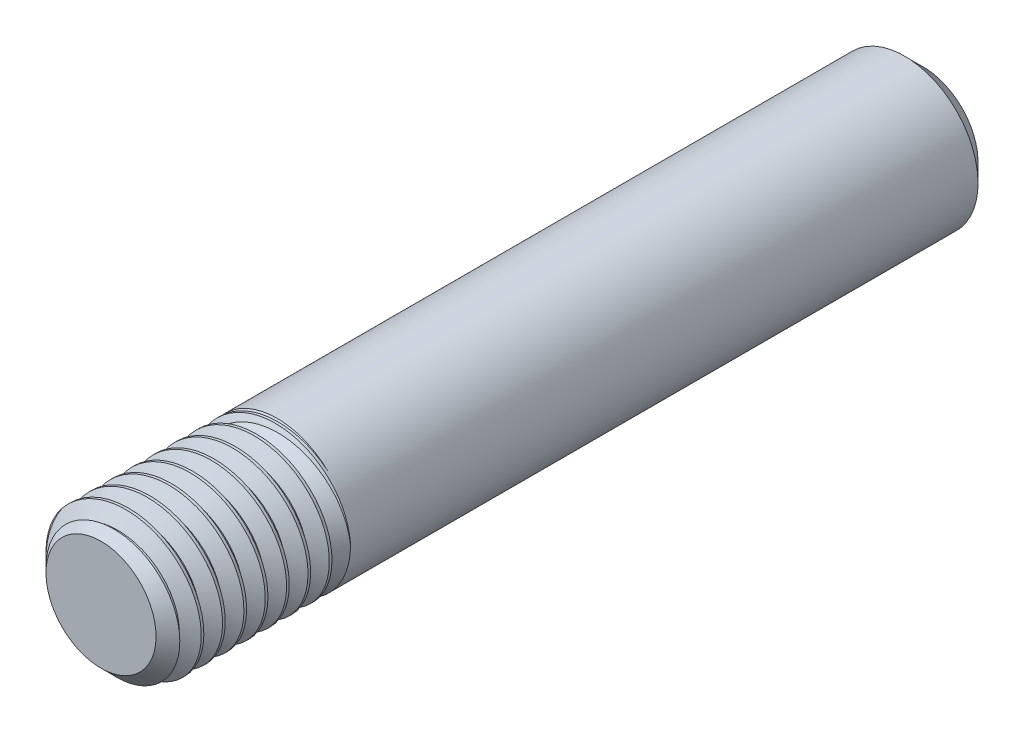
from build123d import *

# Parameters (mm, degrees)
CHAMFER1_SIZE          = 1.984375
CHAMFER2_SIZE          = 1.984375
CUT_SWEEP1_PITCH       = 2.309090909
CUT_SWEEP1_HEIGHT      = 21.359090909
CUT_SWEEP1_RADIUS      = 7.9375
CUT_SWEEP1_START_ANGLE = 90
SKETCH6_R              = 7.9375
BOSS_EXTRUDE1_DEPTH    = 19.05
BOSS_EXTRUDE1_TAPER    = 30


with BuildPart() as part:
    # Sketch3 → Revolve1 (revolve)
    with BuildSketch(Plane(origin=(0, 0, 0), x_dir=(0, 0, -1), z_dir=(1, 0, 0)), mode=Mode.PRIVATE) as revolve1_sk:
        Polygon((-44.45, 0), (44.45, 0), (44.45, 7.9375), (-25.4, 7.9375), (-44.45, 7.9375), align=None)
    revolve(revolve1_sk.sketch.rotate(Axis((0, 0, 44.45), (0, 0, -1)), 180), axis=Axis((0, 0, 44.45), (0, 0, -1)))

    # Chamfer1
    chamfer1_edges = [part.edges().sort_by_distance(p)[0] for p in [
        (0, 7.9375, 44.45),
    ]]
    chamfer(chamfer1_edges, length=CHAMFER1_SIZE)

    # Chamfer2
    chamfer2_edges = [part.edges().sort_by_distance(p)[0] for p in [
        (0, 7.9375, -44.45),
    ]]
    chamfer(chamfer2_edges, length=CHAMFER2_SIZE)


with BuildPart() as body_2:
    # Split1: the piece on the far side of the plane
    add(part.part)
    split(bisect_by=Plane.XY.offset(25.4), keep=Keep.BOTTOM)


with BuildPart() as part_1:
    add(part.part)

    # Split1
    split(bisect_by=Plane.XY.offset(25.4), keep=Keep.TOP)

    # Cut-Sweep1: sweep along a helix
    with BuildLine() as cut_sweep1_path:
        add(Helix(CUT_SWEEP1_PITCH, CUT_SWEEP1_HEIGHT, CUT_SWEEP1_RADIUS, center=(0, 0, 44.45), direction=(0, 0, -1), mode=Mode.PRIVATE).rotate(Axis((0, 0, 44.45), (0, 0, -1)), CUT_SWEEP1_START_ANGLE))
    # Sketch5 → Cut-Sweep1 (sweep, cut)
    with BuildSketch(Plane(origin=(0, 0, 0), x_dir=(0, 0, -1), z_dir=(1, 0, 0))):
        Polygon((-46.542613636, 8.062483212), (-44.377840909, 8.062483212), (-45.315909091, 6.43770146), (-45.604545455, 6.43770146), align=None)
    sweep(path=cut_sweep1_path.line, is_frenet=True, mode=Mode.SUBTRACT)

    add(body_2.part)  # Boss-Extrude1 merges body 2
    # Sketch6 → Boss-Extrude1 (add, through all)
    with BuildSketch(Plane.XY.offset(25.4)):
        with Locations(Location((0, 0, 0), (0, 0, 270))):
            Circle(SKETCH6_R)
    extrude(amount=BOSS_EXTRUDE1_DEPTH, taper=BOSS_EXTRUDE1_TAPER)


solid = part_1.part
